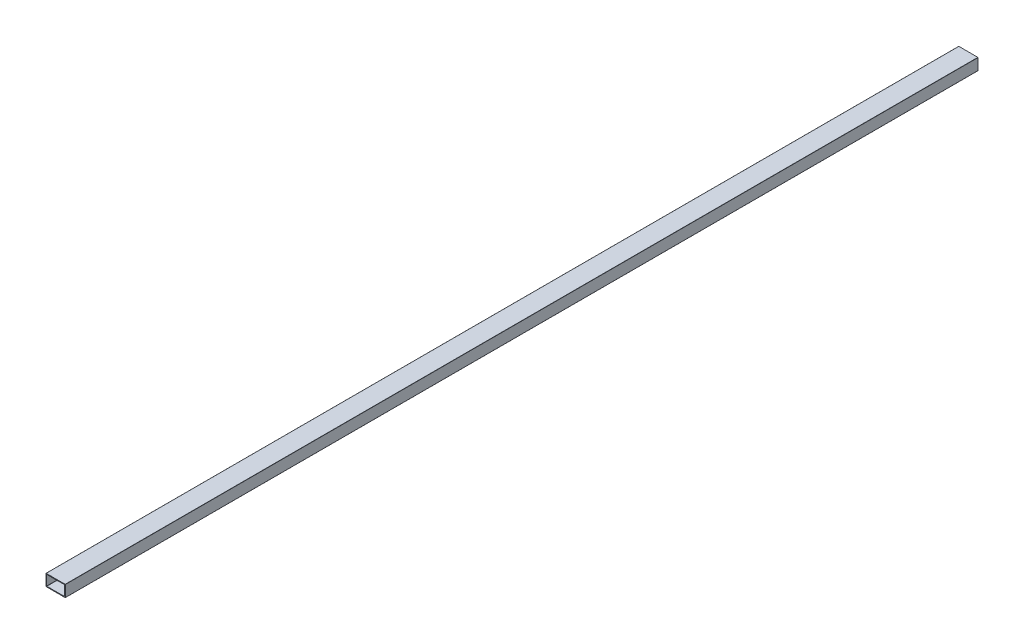
from build123d import *

# Parameters (mm, degrees)
CROQUIS1_W              = 127
CROQUIS1_H              = 76.2
CROQUIS1_W_2            = 117.9
CROQUIS1_H_2            = 67.1
SALIENTE_EXTRUIR1_DEPTH = 6000
REDONDEO1_R             = 1


with BuildPart() as part:
    # Croquis1 → Saliente-Extruir1 (new body)
    with BuildSketch(Plane.XY):
        Rectangle(CROQUIS1_W, CROQUIS1_H)
        Rectangle(CROQUIS1_W_2, CROQUIS1_H_2, mode=Mode.SUBTRACT)
    extrude(amount=-SALIENTE_EXTRUIR1_DEPTH)

    # Redondeo1
    redondeo1_edges = [part.edges().sort_by_distance(p)[0] for p in [
        (58.95, -33.55, -3000),
        (-58.95, -33.55, -3000),
        (-58.95, 33.55, -3000),
        (58.95, 33.55, -3000),
        (63.5, -38.1, -3000),
        (-63.5, -38.1, -3000),
        (-63.5, 38.1, -3000),
        (63.5, 38.1, -3000),
    ]]
    fillet(redondeo1_edges, radius=REDONDEO1_R)


solid = part.part
